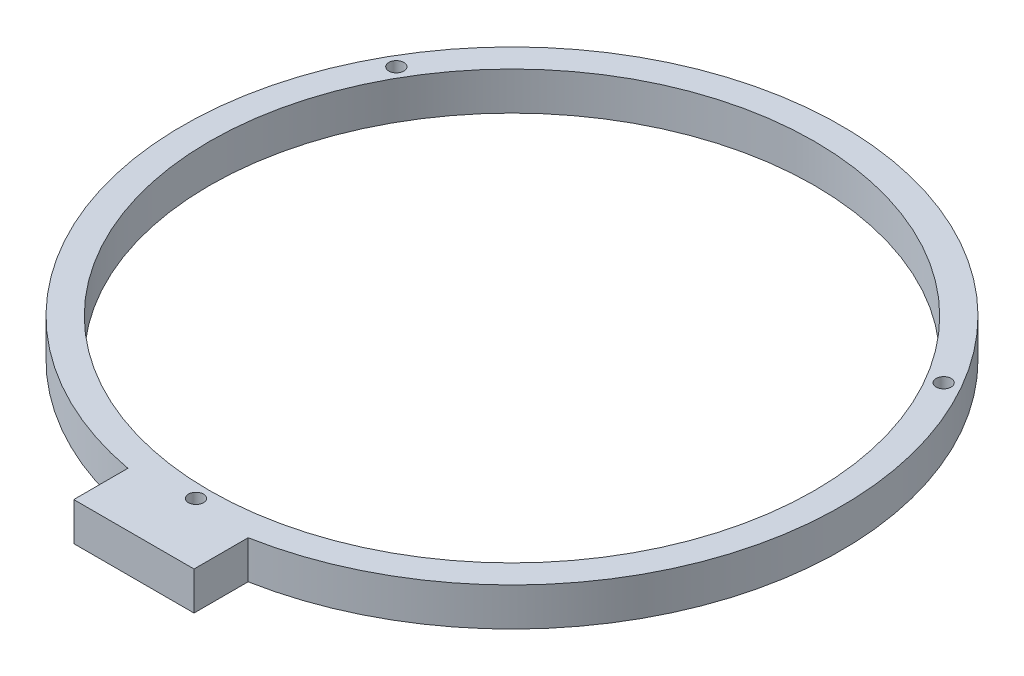
from build123d import *

# Parameters (mm, degrees)
SKETCH1_R           = 50.3
BOSS_EXTRUDE1_DEPTH = 6.35
CUT_EXTRUDE1_REACH  = 85.65
SKETCH2_R           = 1.25
CIRPATTERN1_COUNT   = 3


with BuildPart() as part:
    # Sketch1 → Boss-Extrude1 (new body)
    with BuildSketch(Plane(origin=(0, 0, 0), x_dir=(1, 0, 0), z_dir=(0, 1, 0))):
        with BuildLine():
            Line((-10, -53.87986637), (-10, -62.87986637))
            Line((-10, -62.87986637), (10, -62.87986637))
            Line((10, -62.87986637), (10, -53.87986637))
            ThreePointArc((10, -53.87986637), (0, 54.8), (-10, -53.87986637))
        make_face()
        with Locations(Location((0, 0, 0), (0, 0, 270))):
            Circle(SKETCH1_R, mode=Mode.SUBTRACT)
    extrude(amount=BOSS_EXTRUDE1_DEPTH)

    # Sketch2 → Cut-Extrude1 (cut, up to next)
    with BuildSketch(Plane(origin=(0, 6.35, 0), x_dir=(1, 0, 0), z_dir=(0, 1, 0)), mode=Mode.PRIVATE) as cut_extrude1_sk1:
        with Locations(Location((0, -52.55, 0), (0, 0, 270))):
            Circle(SKETCH2_R)
    cut_extrude1_tool1 = extrude(cut_extrude1_sk1.sketch, amount=-CUT_EXTRUDE1_REACH, mode=Mode.PRIVATE) & part.part
    cut_extrude1 = cut_extrude1_tool1.solids().sort_by_distance((0, 6.35, 52.55))[0]
    add(cut_extrude1, mode=Mode.SUBTRACT)

    # CirPattern1: Cut-Extrude1 ×3 about axis
    cirpattern1_axis = Axis((0, 0, 0), (0, 1, 0))
    for i in range(1, CIRPATTERN1_COUNT):
        add(cut_extrude1.rotate(cirpattern1_axis, i * 360 / CIRPATTERN1_COUNT), mode=Mode.SUBTRACT)


solid = part.part
